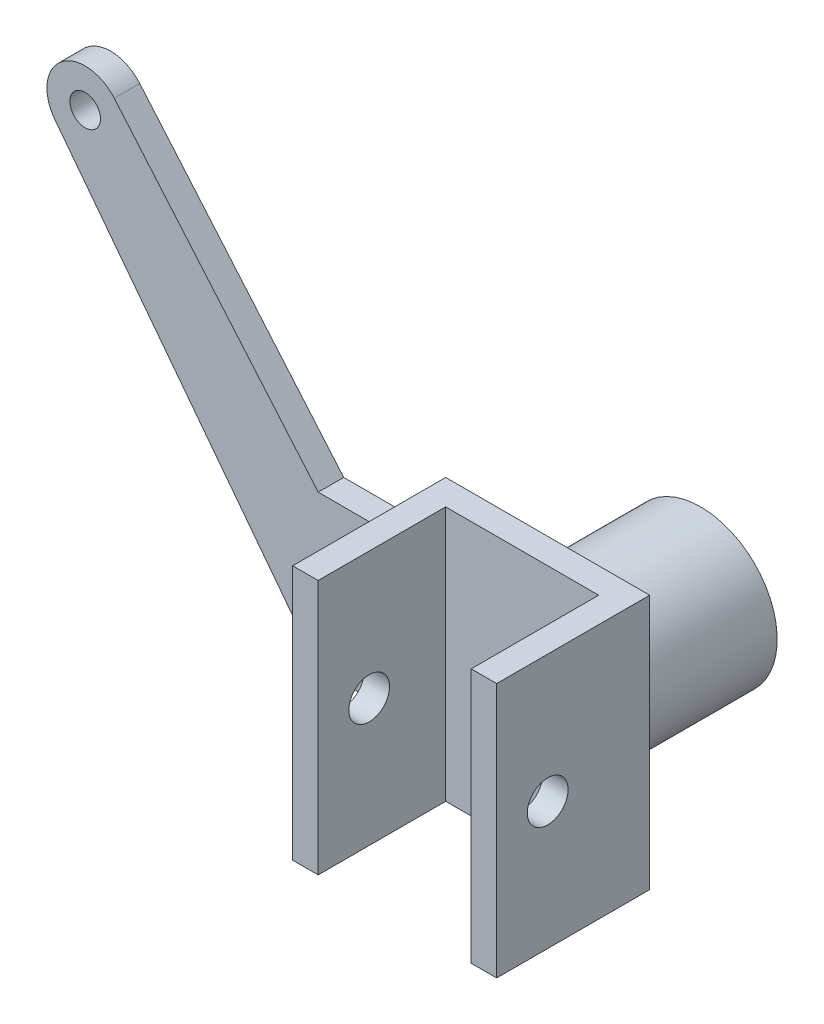
from build123d import *

# Parameters (mm, degrees)
SKETCH1_W           = 40
SKETCH1_H           = 50
BOSS_EXTRUDE1_DEPTH = 5
SKETCH2_W           = 5
SKETCH2_H           = 50
BOSS_EXTRUDE2_DEPTH = 25
SKETCH3_R           = 4
CUT_EXTRUDE1_DEPTH  = 56.901699437
SKETCH4_W           = 5
SKETCH4_H           = 30
BOSS_EXTRUDE3_DEPTH = 20
SKETCH5_R           = 3
BOSS_EXTRUDE4_DEPTH = 5
SKETCH6_R           = 15
BOSS_EXTRUDE5_DEPTH = 30


with BuildPart() as part:
    # Sketch1 → Boss-Extrude1 (new body)
    with BuildSketch(Plane.XY):
        Rectangle(SKETCH1_W, SKETCH1_H)
    extrude(amount=BOSS_EXTRUDE1_DEPTH)

    # Sketch2 → Boss-Extrude2 (add)
    with BuildSketch(Plane.XY.offset(5)):
        with Locations((-17.5, 0)):
            Rectangle(SKETCH2_W, SKETCH2_H)
        with Locations((17.5, 0)):
            Rectangle(SKETCH2_W, SKETCH2_H)
    extrude(amount=BOSS_EXTRUDE2_DEPTH)

    # Sketch3 → Cut-Extrude1 (cut, through all)
    with BuildSketch(Plane.ZY.offset(20)):
        with Locations((20, 0)):
            Circle(SKETCH3_R)
    extrude(amount=-CUT_EXTRUDE1_DEPTH, mode=Mode.SUBTRACT)

    # Sketch4 → Boss-Extrude3 (add)
    with BuildSketch(Plane.ZY.offset(20)):
        with Locations((2.5, 0)):
            Rectangle(SKETCH4_W, SKETCH4_H)
    extrude(amount=BOSS_EXTRUDE3_DEPTH)

    # Sketch5 → Boss-Extrude4 (add)
    with BuildSketch(Plane.XY.offset(5)):
        with BuildLine():
            Line((-40, 15), (-40, -15))
            Line((-40, -15), (-91.641900121, 52.474794317))
            ThreePointArc((-91.641900121, 52.474794317), (-90.399583659, 62.866857636), (-79.978416938, 61.898552722))
            Line((-79.978416938, 61.898552722), (-40, 15))
        make_face()
        with Locations((-85.686070809, 57.033094132)):
            Circle(SKETCH5_R, mode=Mode.SUBTRACT)
    extrude(amount=-BOSS_EXTRUDE4_DEPTH)

    # Sketch6 → Boss-Extrude5 (add)
    with BuildSketch(Plane(origin=(0, 0, 0), x_dir=(-1, 0, 0), z_dir=(0, 0, -1))):
        Circle(SKETCH6_R)
    extrude(amount=BOSS_EXTRUDE5_DEPTH)


solid = part.part
